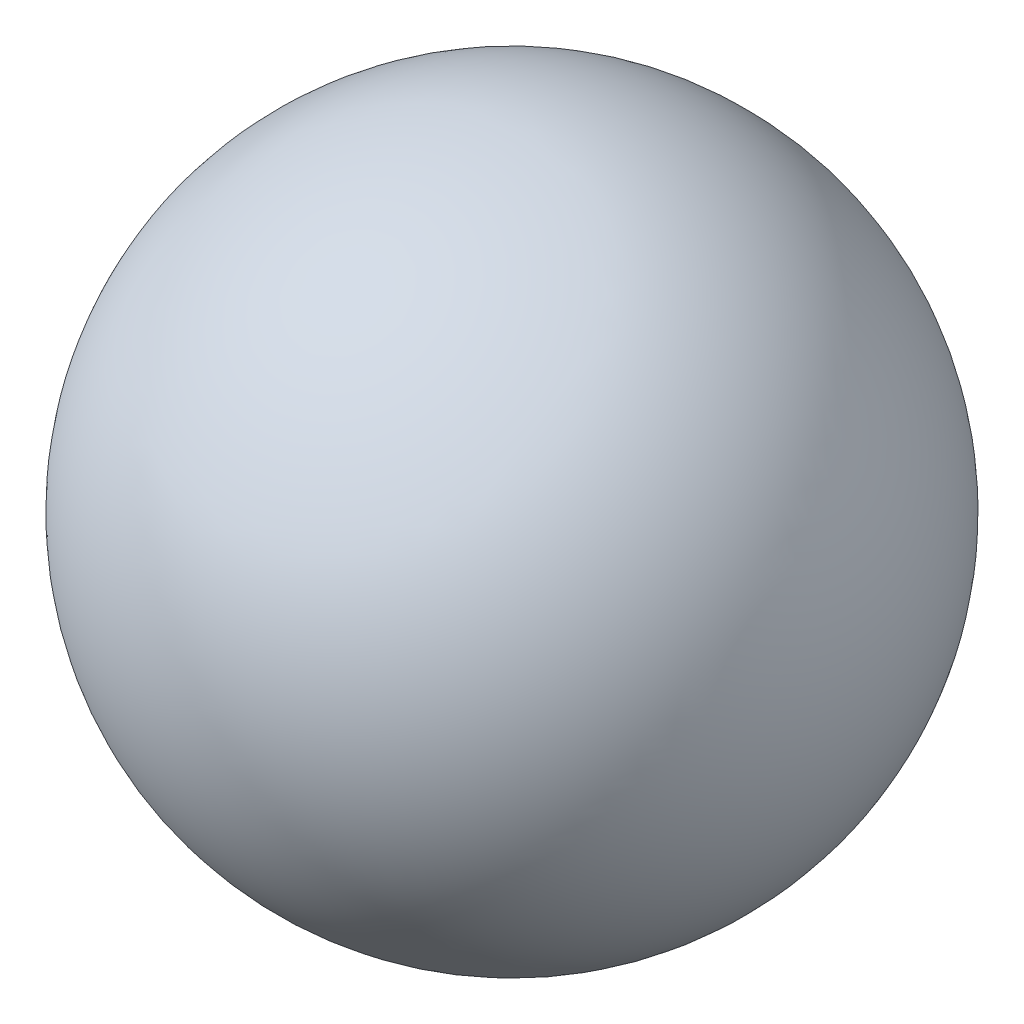
from build123d import *


with BuildPart() as part:
    # Sketch1 → Revolve1 (revolve)
    with BuildSketch(Plane.XY):
        with BuildLine():
            Line((-25, 0), (25, 0))
            ThreePointArc((25, 0), (0, 25), (-25, 0))
        make_face()
    revolve(axis=Axis((-66.193181818, 0, 0), (1, 0, 0)))


solid = part.part
